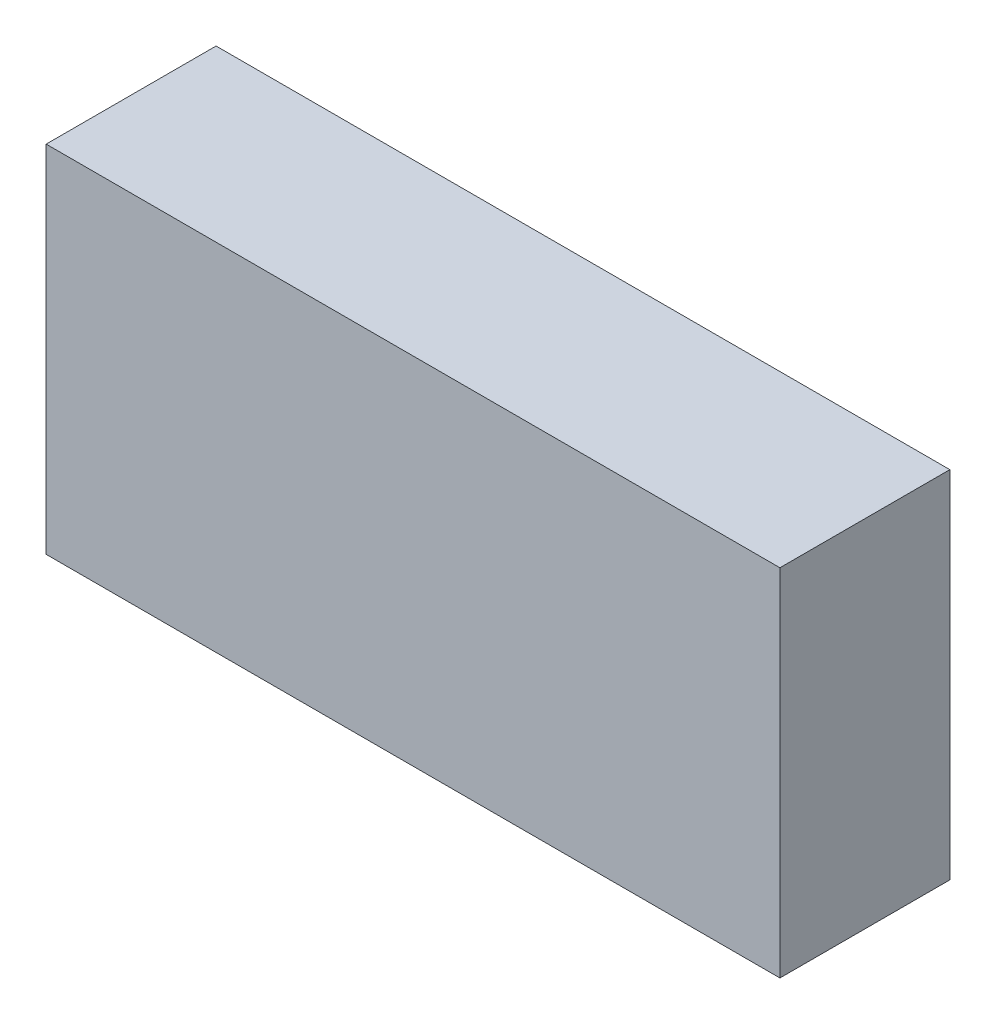
from build123d import *

# Parameters (mm, degrees)
SKETCH1_W           = 95
SKETCH1_H           = 46
BOSS_EXTRUDE1_DEPTH = 22


with BuildPart() as part:
    # Sketch1 → Boss-Extrude1 (new body)
    with BuildSketch(Plane.XY):
        Rectangle(SKETCH1_W, SKETCH1_H)
    extrude(amount=BOSS_EXTRUDE1_DEPTH)


solid = part.part
